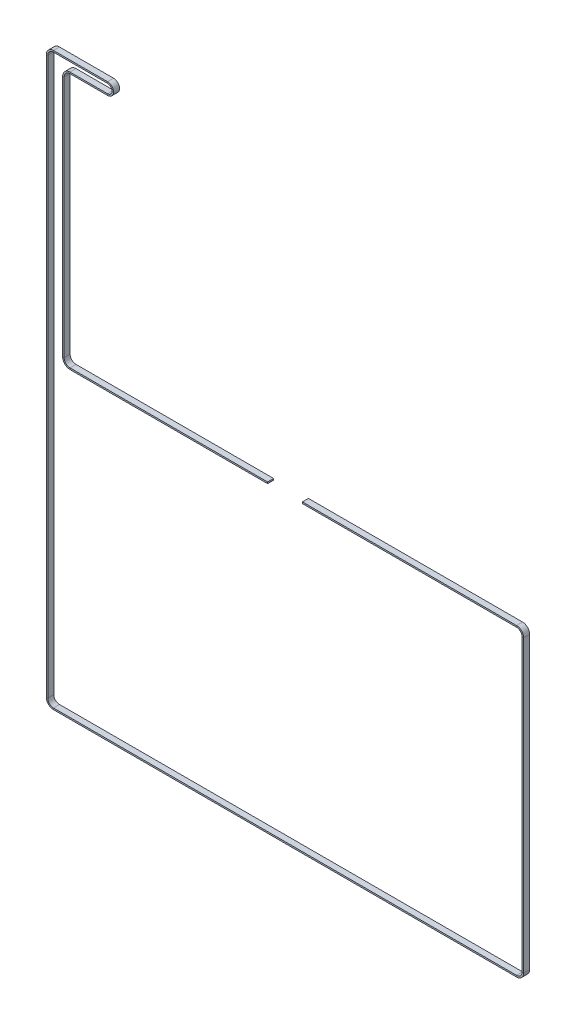
from build123d import *

# Parameters (mm, degrees)
SKETCH2_W = 6
SKETCH2_H = 1.5


with BuildPart() as part:
    # Sweep1: sweep along a path in Sketch1
    with BuildLine(Plane(origin=(0, -21, 4.45), x_dir=(1, 0, 0), z_dir=(0, 0, 1))) as sweep1_path:
        Line((241.85, -192.15), (455.499999991, -192.15))
        ThreePointArc((455.499999991, -192.15), (460.007805721, -194.01719427), (461.874999991, -198.525))
        Line((461.874999991, -198.525), (461.875, -488))
        ThreePointArc((461.875, -488), (460.00780573, -492.50780573), (455.5, -494.375))
        Line((455.5, -494.375), (-6.5, -494.375))
        ThreePointArc((-6.5, -494.375), (-11.00780573, -492.50780573), (-12.875, -488))
        Line((-12.875, -488), (-12.875, 67.325))
        ThreePointArc((-12.875, 67.325), (-11.00780573, 71.83280573), (-6.5, 73.7))
        Line((-6.5, 73.7), (47.5, 73.7))
        ThreePointArc((47.5, 73.7), (52.7, 68.5), (47.5, 63.3))
        Line((47.5, 63.3), (10, 63.3))
        ThreePointArc((10, 63.3), (5.333095244, 61.366904756), (3.4, 56.7))
        Line((3.4, 56.7), (3.39999999, -185.700000014))
        ThreePointArc((3.39999999, -185.700000014), (5.333095234, -190.36690477), (9.99999999, -192.300000015))
        Line((9.99999999, -192.300000015), (207.14999999, -192.300000015))
    # Sketch2 → Sweep1 (sweep)
    with BuildSketch(Plane(origin=(241.85, -213.15, 4.45), x_dir=(0, 0, 1), z_dir=(-1, 0, 0))):
        Rectangle(SKETCH2_W, SKETCH2_H)
    sweep(path=sweep1_path.line)


solid = part.part
